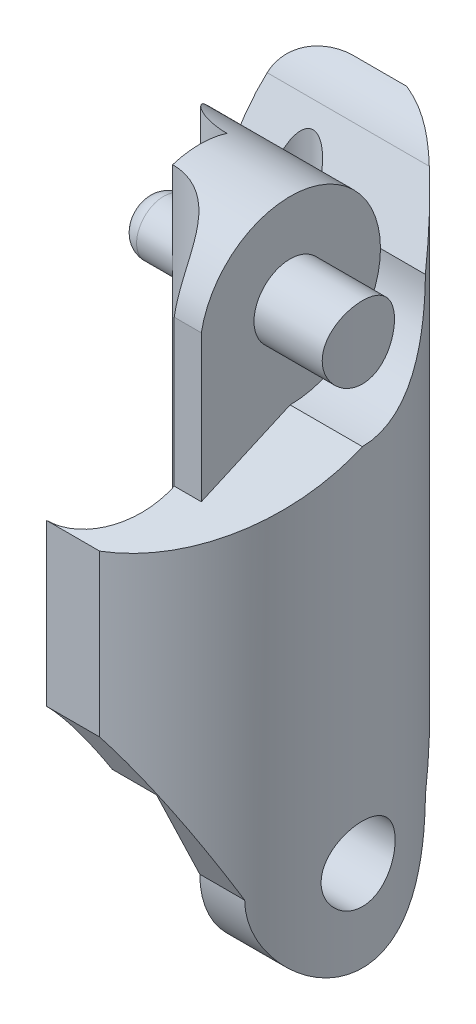
from build123d import *

# Parameters (mm, degrees)
BOSS_EXTRUDE1_DEPTH = 35
SKETCH2_R           = 1.27
CUT_EXTRUDE1_DEPTH  = 35
CUT_EXTRUDE2_REACH  = 41.937
SKETCH3_W           = 10
SKETCH3_H           = 10
SKETCH4_R           = 2.049999964
CUT_EXTRUDE3_DEPTH  = 17.5
CUT_EXTRUDE5_START  = -7.95804
SKETCH6_R           = 2
CUT_EXTRUDE5_DEPTH  = 9.6
FILLET3_R           = 1
CUT_EXTRUDE6_START  = 8.64596
SKETCH6_3_R         = 2
CUT_EXTRUDE6_DEPTH  = 6.604
CUT_EXTRUDE7_START  = -14.986
CUT_EXTRUDE7_DEPTH  = 14.986
CUT_EXTRUDE8_DEPTH  = 31.496
SKETCH9_R           = 1.5
CUT_EXTRUDE9_DEPTH  = 8.382
SKETCH11_R          = 2
CUT_EXTRUDE10_DEPTH = 3.1
BOSS_EXTRUDE2_DEPTH = 3.862
SKETCH13_R          = 1.5
BOSS_EXTRUDE4_DEPTH = 3
FILLET5_R           = 1


with BuildPart() as part:
    # Sketch1 → Boss-Extrude1 (new body)
    with BuildSketch(Plane(origin=(0, 0, 0), x_dir=(1, 0, 0), z_dir=(0, 1, 0))):
        with BuildLine():
            Line((-2.958039892, 8.5), (2.958039892, 8.5))
            ThreePointArc((2.958039892, 8.5), (9, 0), (2.958039892, -8.5))
            Line((2.958039892, -8.5), (-2.958039892, -8.5))
            ThreePointArc((-2.958039892, -8.5), (-9, 0), (-2.958039892, 8.5))
        make_face()
    extrude(amount=BOSS_EXTRUDE1_DEPTH)

    # Sketch2 → Cut-Extrude1 (cut)
    with BuildSketch(Plane.XZ):
        with Locations(Location((0, -5, 0), (0, 0, 270))):
            Circle(SKETCH2_R)
        with Locations(Location((0, 5, 0), (0, 0, 270))):
            Circle(SKETCH2_R)
    extrude(amount=-CUT_EXTRUDE1_DEPTH, mode=Mode.SUBTRACT)

    # Cut-Extrude2: up to this face of the body (flat: up to its plane)
    cut_extrude2_end = Plane(part.part.faces().sort_by_distance((0, 17.5, 8.5))[0])
    # Sketch3 → Cut-Extrude2 (cut, up to the picked face)
    with BuildSketch(Plane(origin=(0, 0, -8.5), x_dir=(-1, 0, 0), z_dir=(0, 0, -1)), mode=Mode.PRIVATE) as cut_extrude2_sk1:
        with Locations((0, 5)):
            Rectangle(SKETCH3_W, SKETCH3_H)
    cut_extrude2_tool1 = split(extrude(cut_extrude2_sk1.sketch, amount=-CUT_EXTRUDE2_REACH, mode=Mode.PRIVATE), bisect_by=cut_extrude2_end, keep=Keep.BOTH, mode=Mode.PRIVATE)
    add(cut_extrude2_tool1.solids().sort_by(Axis((0, 5, -8.5), (0, 0, 1)))[0], mode=Mode.SUBTRACT)

    # Sketch4 → Cut-Extrude3 (cut, symmetric)
    with BuildSketch(Plane.ZY.offset(-5)):
        with Locations(Location((0, 5, 0), (0, 0, 270))):
            Circle(SKETCH4_R)
        with BuildLine():
            Line((-7.483314774, 10), (-5, 5))
            ThreePointArc((-5, 5), (0, 0), (5, 5))
            Line((5, 5), (8.5, 12.308552788))
            Line((8.5, 12.308552788), (9.857943437, -1.822240199))
            Line((9.857943437, -1.822240199), (-9.857943437, -1.822240199))
            Line((-9.857943437, -1.822240199), (-7.483314774, 10))
        make_face()
    extrude(amount=CUT_EXTRUDE3_DEPTH, both=True, mode=Mode.SUBTRACT)

    # Sketch6 → Cut-Extrude5 (cut)
    with BuildSketch(Plane.ZY.offset(2.958039892).offset(CUT_EXTRUDE5_START)):
        with BuildLine():
            Line((8.5, 21.219917379), (0, 25))
            ThreePointArc((0, 25), (-3.535533906, 26.464466094), (-5, 30))
            Line((-5, 30), (-6.755867779, 33.535330675))
            ThreePointArc((-6.755867779, 33.535330675), (-7.475170692, 34.449576169), (-8.5, 35))
            Line((-8.5, 35), (17.803004008, 42.886049022))
            Line((17.803004008, 42.886049022), (8.5, 21.219917379))
        make_face()
        with Locations((0, 30)):
            Circle(SKETCH6_R, mode=Mode.SUBTRACT)
    extrude(amount=-CUT_EXTRUDE5_DEPTH, mode=Mode.SUBTRACT)

    # Fillet3
    fillet3_edges = [part.edges().sort_by_distance(p)[0] for p in [
        (0, 10, -3.73),
        (0, 10, 6.27),
    ]]
    fillet(fillet3_edges, radius=FILLET3_R)

    # Sketch6<3> → Cut-Extrude6 (cut)
    with BuildSketch(Plane.ZY.offset(2.958039892).offset(CUT_EXTRUDE6_START)):
        with BuildLine():
            Line((8.5, 21.219917379), (0, 25))
            ThreePointArc((0, 25), (-3.535533906, 26.464466094), (-5, 30))
            Line((-5, 30), (-6.755867779, 33.535330675))
            ThreePointArc((-6.755867779, 33.535330675), (-7.475170692, 34.449576169), (-8.5, 35))
            Line((-8.5, 35), (17.803004008, 42.886049022))
            Line((17.803004008, 42.886049022), (8.5, 21.219917379))
        make_face()
        with Locations((0, 30)):
            Circle(SKETCH6_3_R, mode=Mode.SUBTRACT)
    extrude(amount=-CUT_EXTRUDE6_DEPTH, mode=Mode.SUBTRACT)

    # Sketch7 → Cut-Extrude7 (cut)
    with BuildSketch(Plane(origin=(5, 0, 0), x_dir=(0, 0, -1), z_dir=(1, 0, 0)).offset(CUT_EXTRUDE7_START)):
        with BuildLine():
            Line((5, 30), (6.755867779, 33.535330675))
            ThreePointArc((6.755867779, 33.535330675), (7.475170692, 34.449576169), (8.5, 35))
            Line((8.5, 35), (-8.341946035, 47.536710192))
            Line((-8.341946035, 47.536710192), (-13.168237897, 33.528506419))
            Line((-13.168237897, 33.528506419), (-10.04678731, 20.532036929))
            Line((-10.04678731, 20.532036929), (-4.915473018, 22.814012455))
            Line((-4.915473018, 22.814012455), (-4.915473018, 30.915491676))
            ThreePointArc((-4.915473018, 30.915491676), (0.459692783, 34.97882341), (5, 30))
        make_face()
    extrude(amount=CUT_EXTRUDE7_DEPTH, mode=Mode.SUBTRACT)

    # Sketch8 → Cut-Extrude8 (cut, symmetric)
    with BuildSketch(Plane.XZ.offset(-10)):
        with BuildLine():
            Line((0, 1.5), (0, -1.5))
            ThreePointArc((0, -1.5), (-3.5, -5), (0, -8.5))
            Line((0, -8.5), (-4.790142834, -16.013604782))
            Line((-4.790142834, -16.013604782), (-17.855559142, -9.717705198))
            Line((-17.855559142, -9.717705198), (-4.790142834, 15.219000931))
            Line((-4.790142834, 15.219000931), (0, 8.5))
            ThreePointArc((0, 8.5), (3.5, 5), (0, 1.5))
        make_face()
    extrude(amount=CUT_EXTRUDE8_DEPTH, both=True, mode=Mode.SUBTRACT)

    # Sketch9 → Cut-Extrude9 (cut)
    with BuildSketch(Plane.ZY):
        with Locations((0, 16)):
            Circle(SKETCH9_R)
    extrude(amount=-CUT_EXTRUDE9_DEPTH, mode=Mode.SUBTRACT)

    # Sketch11 → Cut-Extrude10 (cut, symmetric)
    with BuildSketch(Plane.ZY):
        with Locations((0, 16)):
            Circle(SKETCH11_R)
    extrude(amount=CUT_EXTRUDE10_DEPTH, both=True, mode=Mode.SUBTRACT)

    # Sketch12 → Boss-Extrude2 (add)
    with BuildSketch(Plane.ZY):
        with BuildLine():
            Line((0, 18), (0, 19.5))
            ThreePointArc((0, 19.5), (3.5, 16), (0, 12.5))
            Line((0, 12.5), (0, 14))
            ThreePointArc((0, 14), (2, 16), (0, 18))
        make_face()
    extrude(amount=-BOSS_EXTRUDE2_DEPTH)

    # Sketch13 → Boss-Extrude4 (add)
    with BuildSketch(Plane.ZY):
        with Locations((0, 30)):
            Circle(SKETCH13_R)
    extrude(amount=BOSS_EXTRUDE4_DEPTH)

    # Fillet5
    fillet5_edges = [part.edges().sort_by_distance(p)[0] for p in [
        (-3, 30, -1.5),
    ]]
    fillet(fillet5_edges, radius=FILLET5_R)


solid = part.part
